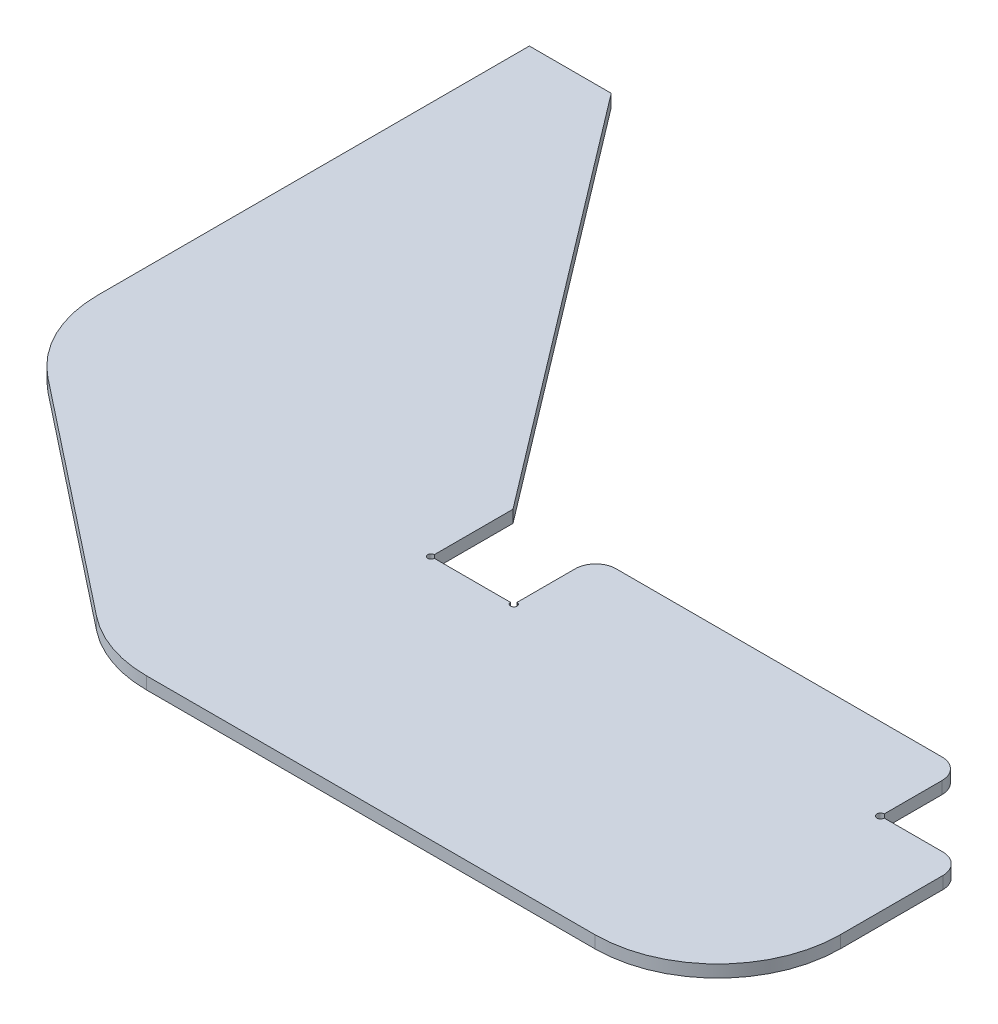
from build123d import *

# Parameters (mm, degrees)
SKETCH1_W           = 150
SKETCH1_H           = 60
BOSS_EXTRUDE1_DEPTH = 3
FILLET1_R           = 30
SKETCH2_W           = 89.6
SKETCH2_H           = 20
BOSS_EXTRUDE2_DEPTH = 3
FILLET2_R           = 30
SKETCH3_R           = 0.8
SKETCH3_R_2         = 0.899402105
CUT_EXTRUDE1_DEPTH  = 160.091168831
FILLET3_R           = 5
SKETCH4_W           = 20
SKETCH4_H           = 100
BOSS_EXTRUDE3_DEPTH = 3
BOSS_EXTRUDE4_DEPTH = 3


with BuildPart() as part:
    # Sketch1 → Boss-Extrude1 (new body)
    with BuildSketch(Plane(origin=(0, 0, 0), x_dir=(1, 0, 0), z_dir=(0, 1, 0))):
        Rectangle(SKETCH1_W, SKETCH1_H)
    extrude(amount=BOSS_EXTRUDE1_DEPTH)

    # Fillet1
    fillet1_edges = [part.edges().sort_by_distance(p)[0] for p in [
        (75, 1.5, 30),
    ]]
    fillet(fillet1_edges, radius=FILLET1_R)

    # Sketch2 → Boss-Extrude2 (add)
    with BuildSketch(Plane(origin=(0, 3, 0), x_dir=(1, 0, 0), z_dir=(0, 1, 0))):
        Polygon((-75, 30), (-55, 30), (-55, 50), (-151, 50), (-151, 30), align=None)
        Polygon((-75, -30), (-75, 30), (-151, 30), align=None)
        with Locations((10, 40)):
            Rectangle(SKETCH2_W, SKETCH2_H)
    extrude(amount=-BOSS_EXTRUDE2_DEPTH)

    # Fillet2
    fillet2_edges = [part.edges().sort_by_distance(p)[0] for p in [
        (-151, 1.5, -30),
        (-75, 1.5, 30),
    ]]
    fillet(fillet2_edges, radius=FILLET2_R)

    # Sketch3 → Cut-Extrude1 (cut, through all)
    with BuildSketch(Plane(origin=(0, 3, 0), x_dir=(1, 0, 0), z_dir=(0, 1, 0))):
        with Locations((-55, 30)):
            Circle(SKETCH3_R)
        with Locations((-34.8, 30)):
            Circle(SKETCH3_R)
        with Locations((54.8, 30)):
            Circle(SKETCH3_R_2)
    extrude(amount=-CUT_EXTRUDE1_DEPTH, mode=Mode.SUBTRACT)

    # Fillet3
    fillet3_edges = [part.edges().sort_by_distance(p)[0] for p in [
        (-34.8, 1.5, -50),
        (54.8, 1.5, -50),
        (75, 1.5, -30),
    ]]
    fillet(fillet3_edges, radius=FILLET3_R)

    # Sketch4 → Boss-Extrude3 (add)
    with BuildSketch(Plane(origin=(0, 0, 0), x_dir=(-1, 0, 0), z_dir=(0, -1, 0))):
        with Locations((141, 100)):
            Rectangle(SKETCH4_W, SKETCH4_H)
    extrude(amount=-BOSS_EXTRUDE3_DEPTH)

    # Sketch5 → Boss-Extrude4 (add)
    with BuildSketch(Plane(origin=(0, 3, 0), x_dir=(1, 0, 0), z_dir=(0, 1, 0))):
        Polygon((-131, 150), (-55, 50), (-131, 50), align=None)
    extrude(amount=-BOSS_EXTRUDE4_DEPTH)


solid = part.part
